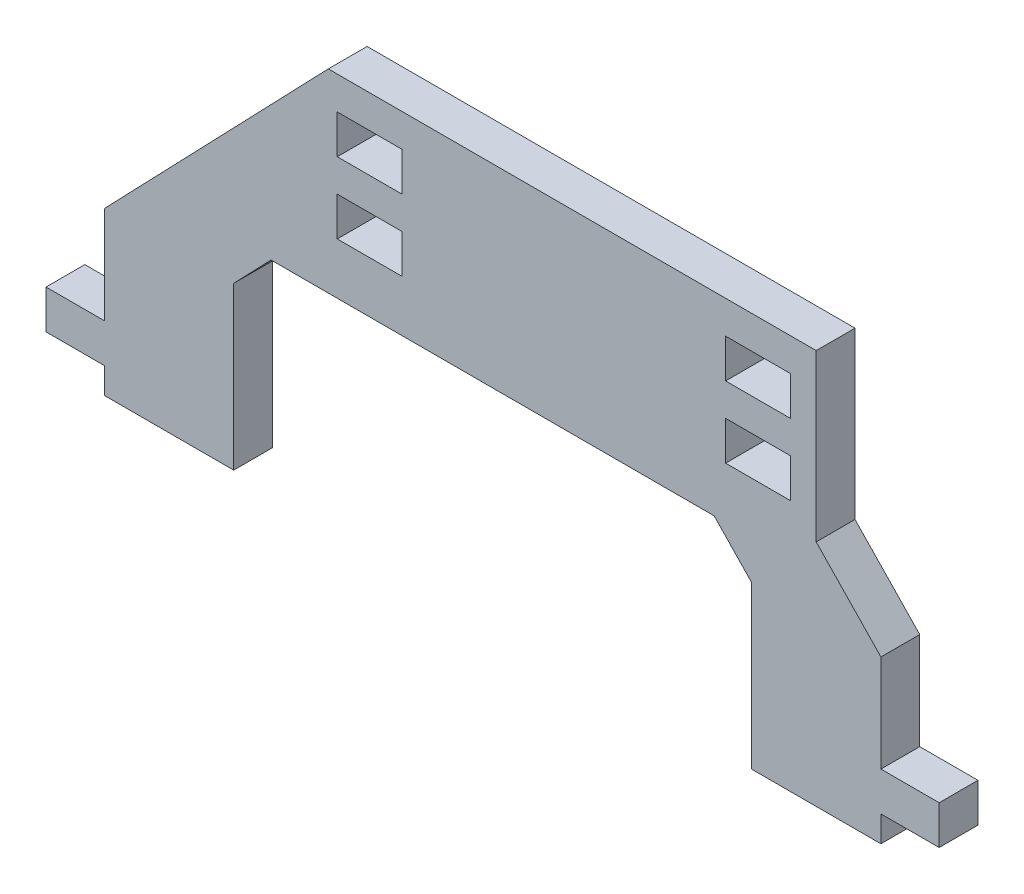
from build123d import *

# Parameters (mm, degrees)
BOSS_EXTRUDE1_DEPTH = 3
SKETCH2_W           = 5
SKETCH2_H           = 3
CUT_EXTRUDE2_DEPTH  = 3


with BuildPart() as part:
    # Sketch1 → Boss-Extrude1 (new body)
    with BuildSketch(Plane.XY):
        Polygon((30, -11.75), (30, -4.25), (25, 0.95), (25, 13.75), (-12.692307692, 13.75), (-25, 0.95), (-30, -4.25), (-30, -11.75), (-34.5, -11.75), (-34.5, -14.75), (-30, -14.75), (-30, -16.75), (-20, -16.75), (-20, -4.25), (-17.115384615, -1.25), (17.115384615, -1.25), (20, -4.25), (20, -16.75), (30, -16.75), (30, -14.75), (34.5, -14.75), (34.5, -11.75), align=None)
    extrude(amount=BOSS_EXTRUDE1_DEPTH)

    # Sketch2 → Cut-Extrude2 (cut)
    with BuildSketch(Plane(origin=(0, 0, 3), x_dir=(-1, 0, 0), z_dir=(0, 0, -1))):
        with Locations((9.5, 4.217126269)):
            Rectangle(SKETCH2_W, SKETCH2_H)
        with Locations((9.5, 9.717126269)):
            Rectangle(SKETCH2_W, SKETCH2_H)
        with Locations((-20.5, 4.217126269)):
            Rectangle(SKETCH2_W, SKETCH2_H)
        with Locations((-20.5, 9.717126269)):
            Rectangle(SKETCH2_W, SKETCH2_H)
    extrude(amount=CUT_EXTRUDE2_DEPTH, mode=Mode.SUBTRACT)


solid = part.part
